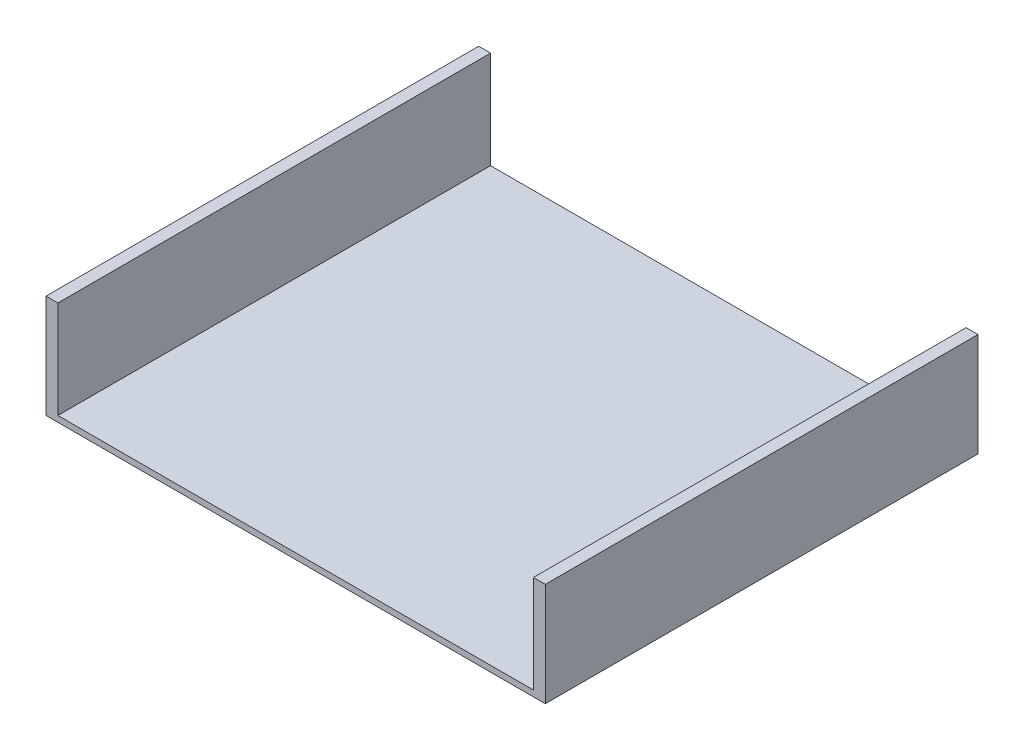
from build123d import *

# Parameters (mm, degrees)
EXTRUDE_1_DEPTH = 182


with BuildPart() as part:
    # 草图1 → 凸台-拉伸1 (new body)
    with BuildSketch(Plane.XY):
        Polygon((-100, -20.5), (-100, 20.5), (-105, 20.5), (-105, -23), (105, -23), (105, 20.5), (100, 20.5), (100, -20.5), align=None)
    extrude(amount=EXTRUDE_1_DEPTH)


solid = part.part
